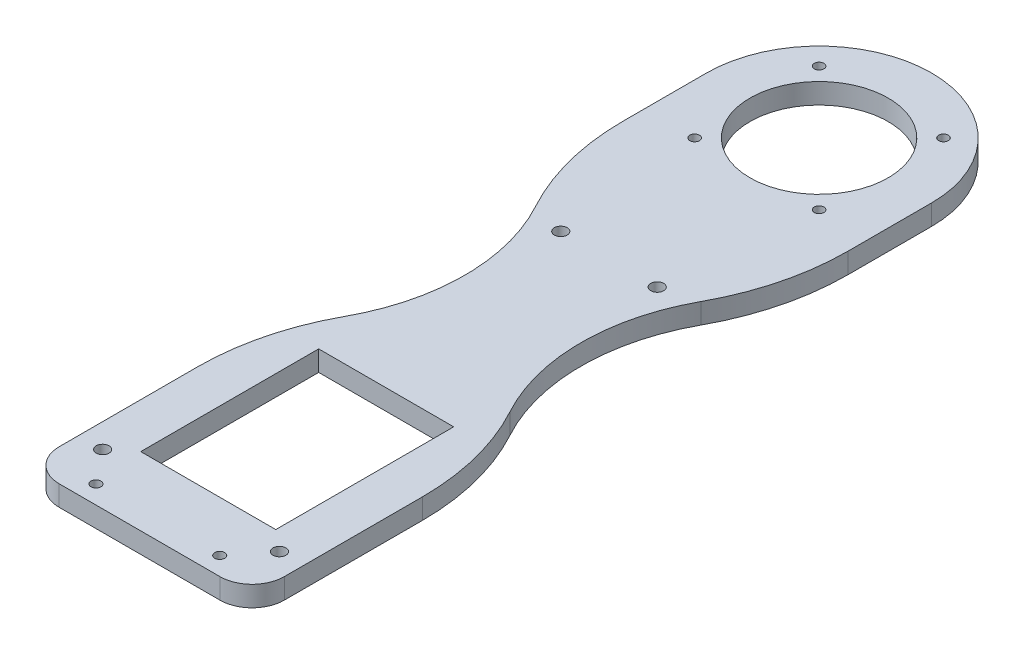
from build123d import *

# Parameters (mm, degrees)
BOSS_EXTRUDE1_DEPTH = 3.175
SKETCH2_R           = 21.5
CUT_EXTRUDE1_DEPTH  = 215.322525648
SKETCH3_W           = 42
SKETCH3_H           = 55.35
CUT_EXTRUDE2_DEPTH  = 215.322525648
SKETCH4_R           = 1.5
CUT_EXTRUDE3_DEPTH  = 215.322525648
FILLET1_R           = 10
SKETCH5_R           = 2
CUT_EXTRUDE4_DEPTH  = 215.322525648
CUT_EXTRUDE5_DEPTH  = 215.322525648
FILLET2_R           = 76
SKETCH7_R           = 1.55
CUT_EXTRUDE6_DEPTH  = 10


with BuildPart() as part:
    # Sketch1 → Boss-Extrude1 (new, symmetric)
    with BuildSketch(Plane(origin=(0, 0, 0), x_dir=(1, 0, 0), z_dir=(0, 1, 0))):
        with BuildLine():
            Line((35, -211.35), (35, 0))
            ThreePointArc((35, 0), (0, 35), (-35, 0))
            Line((-35, 0), (-35, -211.35))
            Line((-35, -211.35), (35, -211.35))
        make_face()
    extrude(amount=BOSS_EXTRUDE1_DEPTH, both=True)

    # Sketch2 → Cut-Extrude1 (cut, through all)
    with BuildSketch(Plane(origin=(0, 3.175, 0), x_dir=(1, 0, 0), z_dir=(0, 1, 0))):
        with Locations(Location((0, 0, 0), (0, 0, 270))):
            Circle(SKETCH2_R)
    extrude(amount=-CUT_EXTRUDE1_DEPTH, mode=Mode.SUBTRACT)

    # Sketch3 → Cut-Extrude2 (cut, through all)
    with BuildSketch(Plane(origin=(0, 3.175, 0), x_dir=(1, 0, 0), z_dir=(0, 1, 0))):
        with Locations((0, -162.325)):
            Rectangle(SKETCH3_W, SKETCH3_H)
    extrude(amount=-CUT_EXTRUDE2_DEPTH, mode=Mode.SUBTRACT)

    # Sketch4 → Cut-Extrude3 (cut, through all)
    with BuildSketch(Plane.XZ.offset(3.175)):
        with Locations(Location((-19.35, 19.35, 0), (0, 0, 270))):
            Circle(SKETCH4_R)
        with Locations(Location((19.35, 19.35, 0), (0, 0, 270))):
            Circle(SKETCH4_R)
        with Locations(Location((19.35, -19.35, 0), (0, 0, 270))):
            Circle(SKETCH4_R)
        with Locations(Location((-19.35, -19.35, 0), (0, 0, 270))):
            Circle(SKETCH4_R)
    extrude(amount=-CUT_EXTRUDE3_DEPTH, mode=Mode.SUBTRACT)

    # Fillet1
    fillet1_edges = [part.edges().sort_by_distance(p)[0] for p in [
        (35, 0, 211.35),
        (-35, 0, 211.35),
    ]]
    fillet(fillet1_edges, radius=FILLET1_R)

    # Sketch5 → Cut-Extrude4 (cut, through all)
    with BuildSketch(Plane(origin=(0, 3.175, 0), x_dir=(1, 0, 0), z_dir=(0, 1, 0))):
        with Locations(Location((15, -65.35, 0), (0, 0, 270))):
            Circle(SKETCH5_R)
        with Locations(Location((-15, -65.35, 0), (0, 0, 270))):
            Circle(SKETCH5_R)
        with Locations(Location((27.5, -195.35, 0), (0, 0, 270))):
            Circle(SKETCH5_R)
        with Locations(Location((-27.5, -195.35, 0), (0, 0, 270))):
            Circle(SKETCH5_R)
    extrude(amount=-CUT_EXTRUDE4_DEPTH, mode=Mode.SUBTRACT)

    # Sketch6 → Cut-Extrude5 (cut, through all)
    with BuildSketch(Plane(origin=(0, 3.175, 0), x_dir=(1, 0, 0), z_dir=(0, 1, 0))):
        with BuildLine():
            Line((-35, -134.65), (-35, -49.65))
            ThreePointArc((-35, -49.65), (-18.102907984, -92.15), (-35, -134.65))
        make_face()
    cut_extrude5 = extrude(amount=-CUT_EXTRUDE5_DEPTH, mode=Mode.SUBTRACT)

    # Mirror1: Cut-Extrude5 across plane
    add(cut_extrude5.mirror(Plane(origin=(0, 0, 0), x_dir=(0, 0, 1), z_dir=(1, 0, 0))), mode=Mode.SUBTRACT)

    # Fillet2
    fillet2_edges = [part.edges().sort_by_distance(p)[0] for p in [
        (35, 0, 134.65),
        (35, 0, 49.65),
        (-35, 0, 49.65),
        (-35, 0, 134.65),
    ]]
    fillet(fillet2_edges, radius=FILLET2_R)

    # Sketch7 → Cut-Extrude6 (cut)
    with BuildSketch(Plane(origin=(0, 3.175, 0), x_dir=(1, 0, 0), z_dir=(0, 1, 0))):
        with Locations(Location((-19.25, -205.675, 0), (0, 0, 270))):
            Circle(SKETCH7_R)
        with Locations(Location((19.25, -205.675, 0), (0, 0, 270))):
            Circle(SKETCH7_R)
    extrude(amount=-CUT_EXTRUDE6_DEPTH, mode=Mode.SUBTRACT)


solid = part.part
